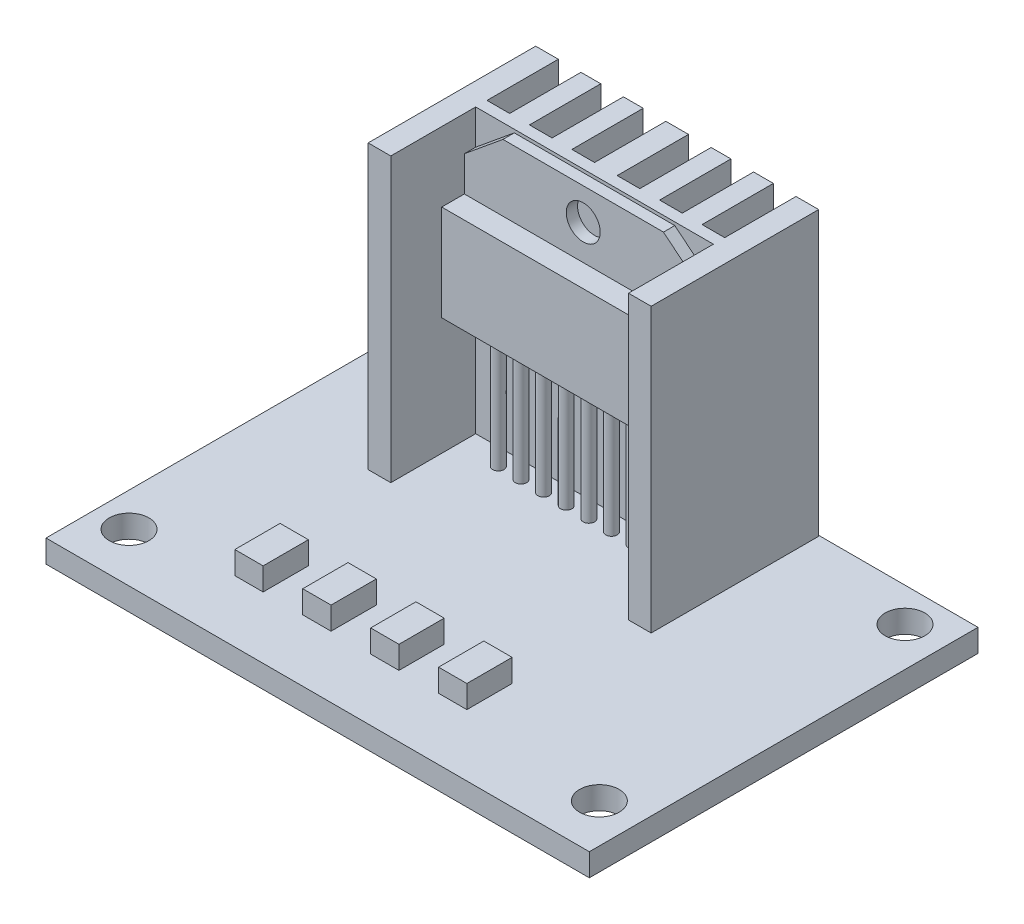
from build123d import *

# Parameters (mm, degrees)
SKETCH1_W                = 43
SKETCH1_H                = 43
SKETCH1_R                = 1.75
BOSS_EXTRUDE1_DEPTH      = 2
BOSS_EXTRUDE2_DEPTH      = 1.5
SKETCH3_R                = 0.69895541
SKETCH3_R_2              = 0.7
BOSS_EXTRUDE3_DEPTH      = 6.5
SKETCH4_W                = 7.9
SKETCH4_H                = 11.24
SKETCH4_W_2              = 16.08
SKETCH4_H_2              = 7.9
BOSS_EXTRUDE4_DEPTH      = 10
BOSS_EXTRUDE5_DEPTH      = 25
SKETCH10_W               = 21
SKETCH10_H               = 8.473082751
BOSS_EXTRUDE6_DEPTH      = 3
SKETCH11_R               = 1.5
BOSS_EXTRUDE7_DEPTH      = 1
SKETCH12_R               = 0.5
BOSS_EXTRUDE8_DEPTH      = 11
SKETCH13_W               = 4
SKETCH13_H               = 5
CUT_EXTRUDE5_DEPTH       = 5
SKETCH16_W               = 2.5
SKETCH16_H               = 4
BOSS_EXTRUDE9_DEPTH      = 2
SKETCH17_W               = 4
SKETCH17_H               = 5
CUT_EXTRUDE6_DEPTH       = 5
SKETCH18_W               = 4
SKETCH18_H               = 5
CUT_EXTRUDE7_DEPTH       = 5
SKETCH19_R               = 2
CUT_EXTRUDE8_DEPTH       = 2
CUT_EXTRUDE9_DEPTH       = 1
BOSS_EXTRUDE10_START     = -2
SKETCH21_R               = 1.75
BOSS_EXTRUDE10_DEPTH     = 2
CUT_EXTRUDE11_DEPTH      = 12
CUT_EXTRUDE11_DEPTH_BACK = 2
SKETCH22_W               = 43
SKETCH22_H               = 8.664223245
SKETCH23_W               = 34.335776755
SKETCH23_H               = 2
BOSS_EXTRUDE11_DEPTH     = 5
SKETCH24_R               = 1.75
CUT_EXTRUDE12_DEPTH      = 5
SKETCH25_W               = 7.9
SKETCH25_H               = 11.24
CUT_EXTRUDE13_DEPTH      = 10
SKETCH26_R               = 1.75
CUT_EXTRUDE14_DEPTH      = 2
SKETCH27_W               = 7.9
SKETCH27_H               = 11.24
CUT_EXTRUDE15_DEPTH      = 10


with BuildPart() as part:
    # Sketch1 → Boss-Extrude1 (new body)
    with BuildSketch(Plane(origin=(0, 0, 0), x_dir=(1, 0, 0), z_dir=(0, 1, 0))):
        Rectangle(SKETCH1_W, SKETCH1_H)
        with Locations(Location((-18.5, -18.5, 0), (0, 0, 270))):
            Circle(SKETCH1_R, mode=Mode.SUBTRACT)
        with Locations(Location((18.5, -18.5, 0), (0, 0, 270))):
            Circle(SKETCH1_R, mode=Mode.SUBTRACT)
        with Locations(Location((-18.5, 18.5, 0), (0, 0, 270))):
            Circle(SKETCH1_R, mode=Mode.SUBTRACT)
        with Locations(Location((18.5, 18.5, 0), (0, 0, 270))):
            Circle(SKETCH1_R, mode=Mode.SUBTRACT)
    extrude(amount=BOSS_EXTRUDE1_DEPTH)

    # Sketch2 → Boss-Extrude2 (add)
    with BuildSketch(Plane(origin=(0, 2, 0), x_dir=(1, 0, 0), z_dir=(0, 1, 0))):
        Polygon((0.830748064, -14.345776755), (0.830748064, -19.775776755), (15.700748064, -19.775776755), (15.700748064, -14.345776755), (13.280748064, -14.345776755), (13.280748064, -16.765776755), (3.250748064, -16.765776755), (3.250748064, -14.345776755), align=None)
    extrude(amount=BOSS_EXTRUDE2_DEPTH)

    # Sketch3 → Boss-Extrude3 (add)
    with BuildSketch(Plane(origin=(0, 3.5, 0), x_dir=(1, 0, 0), z_dir=(0, 1, 0))):
        with Locations(Location((2.040748064, -18.225776755, 0), (0, 0, 90))):
            Circle(SKETCH3_R)
        with Locations(Location((4.530748064, -18.225776755, 0), (0, 0, 90))):
            Circle(SKETCH3_R)
        with Locations(Location((7.020748064, -18.225776755, 0), (0, 0, 90))):
            Circle(SKETCH3_R)
        with Locations(Location((9.510748064, -18.225776755, 0), (0, 0, 90))):
            Circle(SKETCH3_R)
        with Locations(Location((12.000748064, -18.225776755, 0), (0, 0, 90))):
            Circle(SKETCH3_R)
        with Locations(Location((14.490748064, -18.225776755, 0), (0, 0, 90))):
            Circle(SKETCH3_R)
        with Locations(Location((2.040748064, -15.735776755, 0), (0, 0, 90))):
            Circle(SKETCH3_R_2)
        with Locations(Location((14.490748064, -15.735776755, 0), (0, 0, 90))):
            Circle(SKETCH3_R_2)
    extrude(amount=BOSS_EXTRUDE3_DEPTH)

    # Sketch4 → Boss-Extrude4 (add)
    with BuildSketch(Plane(origin=(0, 2, 0), x_dir=(1, 0, 0), z_dir=(0, 1, 0))):
        with Locations((-17.229251936, -6.515776755)):
            Rectangle(SKETCH4_W, SKETCH4_H)
        with Locations((-7.599251936, -17.325776755)):
            Rectangle(SKETCH4_W_2, SKETCH4_H_2)
        with Locations((17.229251936, -6.515776755)):
            Rectangle(SKETCH4_W, SKETCH4_H)
    extrude(amount=BOSS_EXTRUDE4_DEPTH)

    # Sketch8 → Boss-Extrude5 (add)
    with BuildSketch(Plane(origin=(0, 2, 0), x_dir=(1, 0, 0), z_dir=(0, 1, 0))):
        Polygon((3, 21.424223245), (4.75, 21.424223245), (4.75, 15.124223245), (6.75, 15.124223245), (6.75, 21.424223245), (8.5, 21.424223245), (8.5, 15.124223245), (10.5, 15.124223245), (10.5, 21.424223245), (12.5, 21.424223245), (12.5, 6.624223245), (10.5, 6.624223245), (10.5, 14.124223245), (-10.5, 14.124223245), (-10.5, 6.624223245), (-12.5, 6.624223245), (-12.5, 21.424223245), (-10.5, 21.424223245), (-10.5, 15.124223245), (-8.5, 15.124223245), (-8.5, 21.424223245), (-6.75, 21.424223245), (-6.75, 15.124223245), (-4.75, 15.124223245), (-4.75, 21.424223245), (-3, 21.424223245), (-3, 15.124223245), (-1, 15.124223245), (-1, 21.424223245), (1, 21.424223245), (1, 15.124223245), (3, 15.124223245), align=None)
    extrude(amount=BOSS_EXTRUDE5_DEPTH)

    # Sketch10 → Boss-Extrude6 (add)
    with BuildSketch(Plane.XY.offset(-14.124223245)):
        with Locations((0, 16.604600605)):
            Rectangle(SKETCH10_W, SKETCH10_H)
    extrude(amount=BOSS_EXTRUDE6_DEPTH)

    # Sketch11 → Boss-Extrude7 (add)
    with BuildSketch(Plane.XY.offset(-14.124223245)):
        Polygon((-10.5, 23.92057099), (-7.090362565, 26.720500705), (7.090362565, 26.720500705), (10.5, 23.92057099), (10.5, 20.841141981), (-10.5, 20.841141981), align=None)
        with Locations((0, 23.92057099)):
            Circle(SKETCH11_R, mode=Mode.SUBTRACT)
    extrude(amount=BOSS_EXTRUDE7_DEPTH)

    # Sketch12 → Boss-Extrude8 (add)
    with BuildSketch(Plane(origin=(0, 2, 0), x_dir=(1, 0, 0), z_dir=(0, 1, 0))):
        with Locations(Location((-7, 12.624223245, 0), (0, 0, 90))):
            Circle(SKETCH12_R)
        with Locations(Location((-5, 12.624223245, 0), (0, 0, 90))):
            Circle(SKETCH12_R)
        with Locations(Location((-3, 12.624223245, 0), (0, 0, 90))):
            Circle(SKETCH12_R)
        with Locations(Location((-1, 12.624223245, 0), (0, 0, 90))):
            Circle(SKETCH12_R)
        with Locations(Location((1, 12.624223245, 0), (0, 0, 90))):
            Circle(SKETCH12_R)
        with Locations(Location((3, 12.624223245, 0), (0, 0, 90))):
            Circle(SKETCH12_R)
        with Locations(Location((5, 12.624223245, 0), (0, 0, 90))):
            Circle(SKETCH12_R)
        with Locations(Location((7, 12.624223245, 0), (0, 0, 90))):
            Circle(SKETCH12_R)
    extrude(amount=BOSS_EXTRUDE8_DEPTH)

    # Sketch13 → Cut-Extrude5 (cut)
    with BuildSketch(Plane.ZY.offset(21.179251936)):
        with Locations((4.015776755, 5.5)):
            Rectangle(SKETCH13_W, SKETCH13_H)
        with Locations((9.015776755, 5.5)):
            Rectangle(SKETCH13_W, SKETCH13_H)
    extrude(amount=-CUT_EXTRUDE5_DEPTH, mode=Mode.SUBTRACT)

    # Sketch16 → Boss-Extrude9 (add)
    with BuildSketch(Plane(origin=(0, 2, 0), x_dir=(1, 0, 0), z_dir=(0, 1, 0))):
        with Locations((-9.029251936, -5.375776755)):
            Rectangle(SKETCH16_W, SKETCH16_H)
        with Locations((-3.029251936, -5.375776755)):
            Rectangle(SKETCH16_W, SKETCH16_H)
        with Locations((2.970748064, -5.375776755)):
            Rectangle(SKETCH16_W, SKETCH16_H)
        with Locations((8.970748064, -5.375776755)):
            Rectangle(SKETCH16_W, SKETCH16_H)
    extrude(amount=BOSS_EXTRUDE9_DEPTH)

    # Sketch17 → Cut-Extrude6 (cut)
    with BuildSketch(Plane.XY.offset(21.275776755)):
        with Locations((-13.139251936, 5.5)):
            Rectangle(SKETCH17_W, SKETCH17_H)
        with Locations((-7.639251936, 5.5)):
            Rectangle(SKETCH17_W, SKETCH17_H)
        with Locations((-2.139251936, 5.5)):
            Rectangle(SKETCH17_W, SKETCH17_H)
    extrude(amount=-CUT_EXTRUDE6_DEPTH, mode=Mode.SUBTRACT)

    # Sketch18 → Cut-Extrude7 (cut)
    with BuildSketch(Plane(origin=(21.179251936, 0, 0), x_dir=(0, 0, -1), z_dir=(1, 0, 0))):
        with Locations((-9.015776755, 5.5)):
            Rectangle(SKETCH18_W, SKETCH18_H)
        with Locations((-4.015776755, 5.5)):
            Rectangle(SKETCH18_W, SKETCH18_H)
    extrude(amount=-CUT_EXTRUDE7_DEPTH, mode=Mode.SUBTRACT)

    # Sketch19 → Cut-Extrude8 (cut)
    with BuildSketch(Plane(origin=(0, 12, 0), x_dir=(1, 0, 0), z_dir=(0, 1, 0))):
        with Locations(Location((-17.229251936, -3.895776755, 0), (0, 0, 270))):
            Circle(SKETCH19_R)
        with Locations(Location((-17.229251936, -9.135776755, 0), (0, 0, 270))):
            Circle(SKETCH19_R)
        with Locations(Location((-12.639251936, -17.325776755, 0), (0, 0, 270))):
            Circle(SKETCH19_R)
        with Locations(Location((-7.639251936, -17.325776755, 0), (0, 0, 270))):
            Circle(SKETCH19_R)
        with Locations(Location((-2.639251936, -17.325776755, 0), (0, 0, 270))):
            Circle(SKETCH19_R)
        with Locations(Location((17.229251936, -9.135776755, 0), (0, 0, 90))):
            Circle(SKETCH19_R)
        with Locations(Location((17.229251936, -3.895776755, 0), (0, 0, 90))):
            Circle(SKETCH19_R)
    extrude(amount=-CUT_EXTRUDE8_DEPTH, mode=Mode.SUBTRACT)

    # Sketch20 → Cut-Extrude9 (cut)
    with BuildSketch(Plane(origin=(0, 10, 0), x_dir=(1, 0, 0), z_dir=(0, 1, 0))):
        with BuildLine():
            Line((-8.314251936, -15.443125699), (-8.314251936, -19.208427811))
            ThreePointArc((-8.314251936, -19.208427811), (-7.639251936, -19.325776755), (-6.964251936, -19.208427811))
            Line((-6.964251936, -19.208427811), (-6.964251936, -15.443125699))
            ThreePointArc((-6.964251936, -15.443125699), (-7.639251936, -15.325776755), (-8.314251936, -15.443125699))
        make_face()
        with BuildLine():
            Line((-3.314251936, -15.443125699), (-3.314251936, -19.208427811))
            ThreePointArc((-3.314251936, -19.208427811), (-2.639251936, -19.325776755), (-1.964251936, -19.208427811))
            Line((-1.964251936, -19.208427811), (-1.964251936, -15.443125699))
            ThreePointArc((-1.964251936, -15.443125699), (-2.639251936, -15.325776755), (-3.314251936, -15.443125699))
        make_face()
        with BuildLine():
            Line((-16.554251936, -2.013478411), (-16.554251936, -5.778075099))
            ThreePointArc((-16.554251936, -5.778075099), (-17.229251936, -5.895444741), (-17.904251936, -5.778075099))
            Line((-17.904251936, -5.778075099), (-17.904251936, -2.013478411))
            ThreePointArc((-17.904251936, -2.013478411), (-17.229251936, -1.896108769), (-16.554251936, -2.013478411))
        make_face()
        with BuildLine():
            Line((-16.554251936, -11.018075099), (-16.554251936, -7.253478411))
            ThreePointArc((-16.554251936, -7.253478411), (-17.229251936, -7.136108769), (-17.904251936, -7.253478411))
            Line((-17.904251936, -7.253478411), (-17.904251936, -11.018075099))
            ThreePointArc((-17.904251936, -11.018075099), (-17.229251936, -11.135444741), (-16.554251936, -11.018075099))
        make_face()
        with BuildLine():
            Line((-11.964251936, -19.216907159), (-11.964251936, -15.434646351))
            ThreePointArc((-11.964251936, -15.434646351), (-12.639251936, -15.317792889), (-13.314251936, -15.434646351))
            Line((-13.314251936, -15.434646351), (-13.314251936, -19.216907159))
            ThreePointArc((-13.314251936, -19.216907159), (-12.639251936, -19.333760621), (-11.964251936, -19.216907159))
        make_face()
        with BuildLine():
            Line((17.904251936, -11.018075099), (17.904251936, -7.253478411))
            ThreePointArc((17.904251936, -7.253478411), (17.229251936, -7.136108769), (16.554251936, -7.253478411))
            Line((16.554251936, -7.253478411), (16.554251936, -11.018075099))
            ThreePointArc((16.554251936, -11.018075099), (17.229251936, -11.135444741), (17.904251936, -11.018075099))
        make_face()
        with BuildLine():
            Line((17.904251936, -2.013478411), (17.904251936, -5.778075099))
            ThreePointArc((17.904251936, -5.778075099), (17.229251936, -5.895444741), (16.554251936, -5.778075099))
            Line((16.554251936, -5.778075099), (16.554251936, -2.013478411))
            ThreePointArc((16.554251936, -2.013478411), (17.229251936, -1.896108769), (17.904251936, -2.013478411))
        make_face()
    extrude(amount=-CUT_EXTRUDE9_DEPTH, mode=Mode.SUBTRACT)

    # Sketch21 → Boss-Extrude10 (add)
    with BuildSketch(Plane(origin=(0, 2, 0), x_dir=(1, 0, 0), z_dir=(0, 1, 0)).offset(BOSS_EXTRUDE10_START)):
        with Locations((18.5, 18.5)):
            Circle(SKETCH21_R)
        with Locations((-18.5, -18.5)):
            Circle(SKETCH21_R)
        with Locations((18.5, -18.5)):
            Circle(SKETCH21_R)
    extrude(amount=BOSS_EXTRUDE10_DEPTH)

    # Sketch22 → Cut-Extrude11 (cut, two sides: drawn at the far end of the back side and taken through both)
    with BuildSketch(Plane(origin=(0, 2, 0), x_dir=(1, 0, 0), z_dir=(0, 1, 0)).offset(-CUT_EXTRUDE11_DEPTH_BACK)):
        with Locations((0, -17.167888377)):
            Rectangle(SKETCH22_W, SKETCH22_H)
    extrude(amount=CUT_EXTRUDE11_DEPTH + CUT_EXTRUDE11_DEPTH_BACK, mode=Mode.SUBTRACT)

    # Sketch23 → Boss-Extrude11 (add)
    with BuildSketch(Plane(origin=(21.5, 0, 0), x_dir=(0, 0, -1), z_dir=(1, 0, 0))):
        with Locations((4.332111622, 1)):
            Rectangle(SKETCH23_W, SKETCH23_H)
    extrude(amount=BOSS_EXTRUDE11_DEPTH)

    # Sketch24 → Cut-Extrude12 (cut)
    with BuildSketch(Plane(origin=(0, 2, 0), x_dir=(1, 0, 0), z_dir=(0, 1, 0))):
        with Locations(Location((23.05, 18.5, 0), (0, 0, 270))):
            Circle(SKETCH24_R)
        with Locations(Location((23.05, -8.5, 0), (0, 0, 270))):
            Circle(SKETCH24_R)
    extrude(amount=-CUT_EXTRUDE12_DEPTH, mode=Mode.SUBTRACT)

    # Sketch25 → Cut-Extrude13 (cut)
    with BuildSketch(Plane(origin=(0, 12, 0), x_dir=(1, 0, 0), z_dir=(0, 1, 0))):
        with Locations((-17.229251936, -6.515776755)):
            Rectangle(SKETCH25_W, SKETCH25_H)
    extrude(amount=-CUT_EXTRUDE13_DEPTH, mode=Mode.SUBTRACT)

    # Sketch26 → Cut-Extrude14 (cut)
    with BuildSketch(Plane(origin=(0, 2, 0), x_dir=(1, 0, 0), z_dir=(0, 1, 0))):
        with Locations(Location((-18.5, -8.5, 0), (0, 0, 270))):
            Circle(SKETCH26_R)
    extrude(amount=-CUT_EXTRUDE14_DEPTH, mode=Mode.SUBTRACT)

    # Sketch27 → Cut-Extrude15 (cut)
    with BuildSketch(Plane(origin=(0, 12, 0), x_dir=(1, 0, 0), z_dir=(0, 1, 0))):
        with Locations((17.229251936, -6.515776755)):
            Rectangle(SKETCH27_W, SKETCH27_H)
    extrude(amount=-CUT_EXTRUDE15_DEPTH, mode=Mode.SUBTRACT)


solid = part.part
